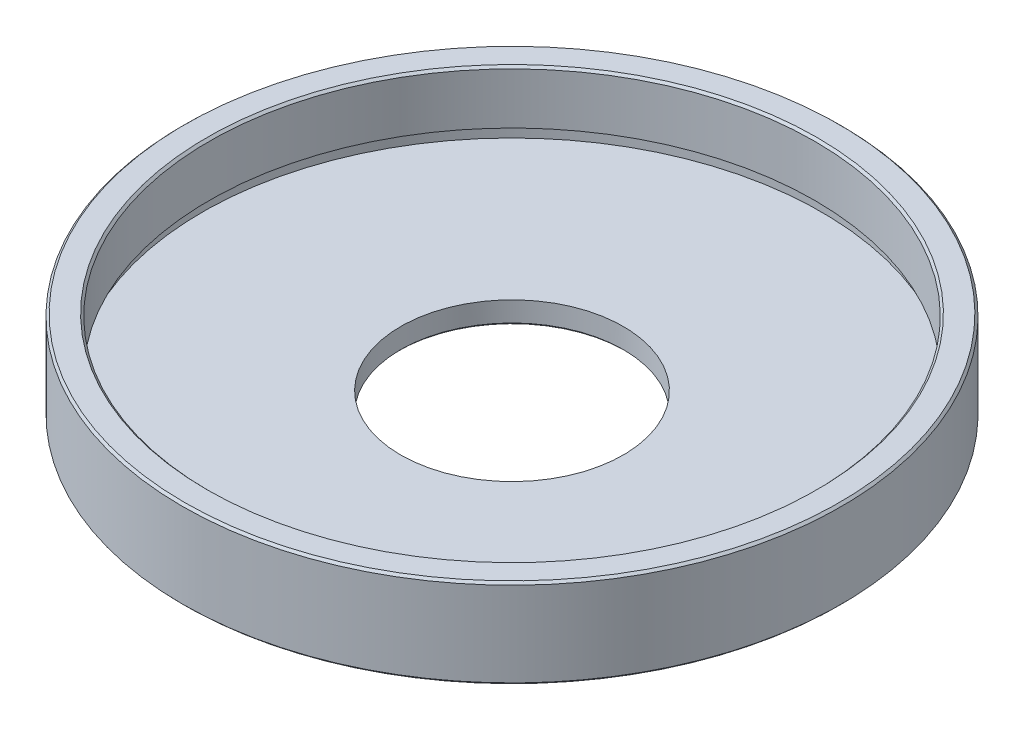
from build123d import *

# Parameters (mm, degrees)
CHAMFER_1_SIZE = 0.5


with BuildPart() as part:
    # Эскиз1 → Повернуть1 (revolve)
    with BuildSketch(Plane.XY):
        Polygon((-74, 20), (-74, 0), (-25, 0), (-25, 5), (-69.5, 5), (-69.5, 8), (-68, 8), (-68, 20), align=None)
    revolve(axis=Axis((0, 26.168985987, 0), (0, -1, 0)))

    # Фаска1
    chamfer_1_edges = [part.edges().sort_by_distance(p)[0] for p in [
        (25, 0, 0),
        (74, 0, 0),
        (74, 20, 0),
        (68, 20, 0),
    ]]
    chamfer(chamfer_1_edges, length=CHAMFER_1_SIZE)


solid = part.part
